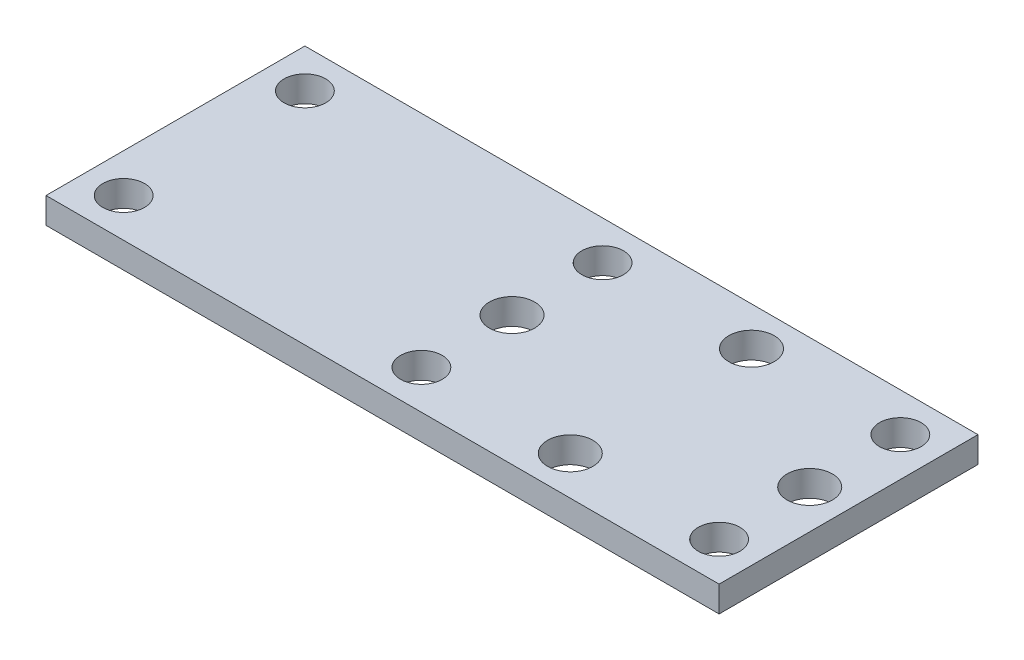
from build123d import *

# Parameters (mm, degrees)
SKETCH1_W                                      = 82.55
SKETCH1_H                                      = 31.75
PLATE_DEPTH                                    = 1.5875
F_10_CLEARANCE_HOLE1_D                         = 5.1054
CBORE_FOR_4_SOCKET_HEAD_CAP_SCREW1_D           = 3.2639
CBORE_FOR_4_SOCKET_HEAD_CAP_SCREW1_CBORE_D     = 5.55752
CBORE_FOR_4_SOCKET_HEAD_CAP_SCREW1_CBORE_DEPTH = 9.1948


with BuildPart() as part:
    # Sketch1 → Plate (new, symmetric)
    with BuildSketch(Plane(origin=(0, 0, 0), x_dir=(1, 0, 0), z_dir=(0, 1, 0))):
        Rectangle(SKETCH1_W, SKETCH1_H)
    extrude(amount=PLATE_DEPTH, both=True)

    # #10 Clearance Hole1 (through all)
    with Locations(Plane(origin=(0, 1.5875, 0), x_dir=(1, 0, 0), z_dir=(0, 1, 0))):
        with Locations((-36.5125, 11.1125), (36.5125, 11.1125), (36.5125, -11.1125), (-36.5125, -11.1125), (0, -11.1125), (0, 11.1125)):
            Hole(F_10_CLEARANCE_HOLE1_D / 2)

    # CBORE for #4 Socket Head Cap Screw1 (through all)
    with Locations(Plane(origin=(0, 1.5875, 0), x_dir=(1, 0, 0), z_dir=(0, 1, 0))):
        with Locations((0, 0), (36.5125, 0), (18.25625, 11.1125), (18.25625, -11.1125)):
            CounterBoreHole(CBORE_FOR_4_SOCKET_HEAD_CAP_SCREW1_D / 2, CBORE_FOR_4_SOCKET_HEAD_CAP_SCREW1_CBORE_D / 2, CBORE_FOR_4_SOCKET_HEAD_CAP_SCREW1_CBORE_DEPTH)


solid = part.part
